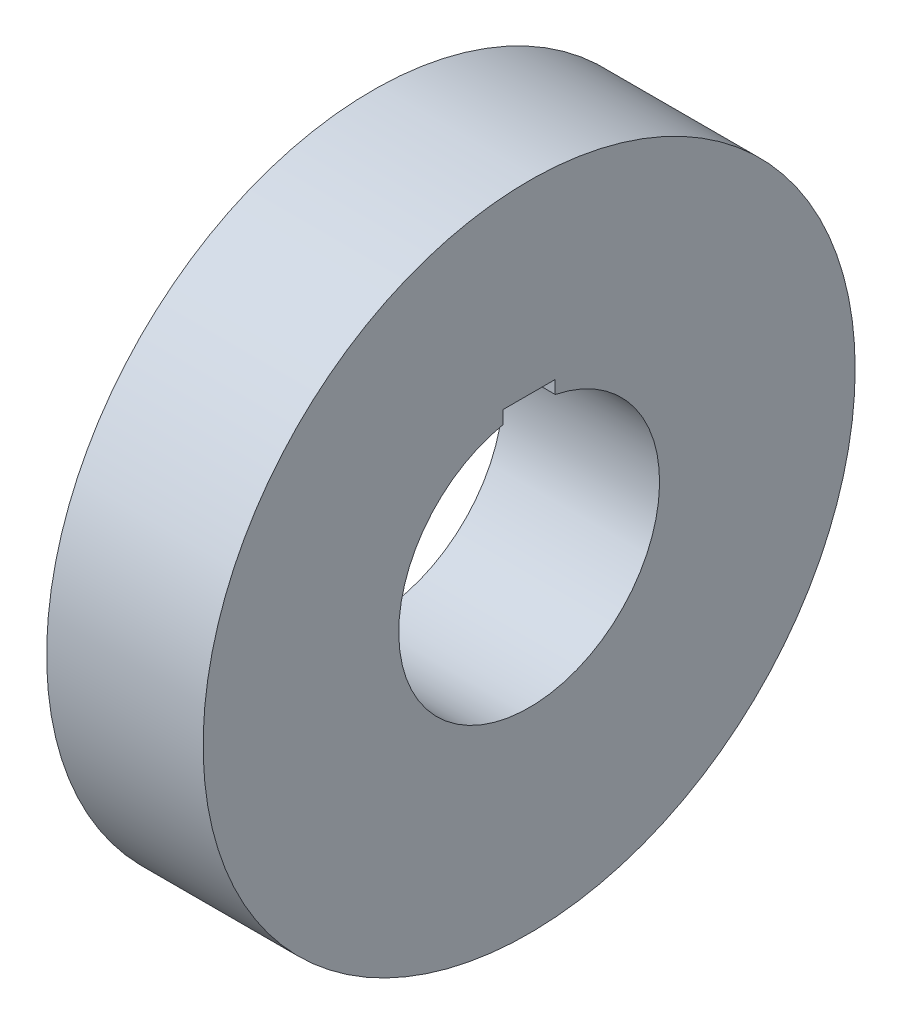
from build123d import *

# Parameters (mm, degrees)
SKETCH1_R           = 25
SKETCH1_R_2         = 10
BOSS_EXTRUDE1_DEPTH = 12
CUT_EXTRUDE1_DEPTH  = 38.336309405


with BuildPart() as part:
    # Sketch1 → Boss-Extrude1 (new body)
    with BuildSketch(Plane(origin=(0, 0, 0), x_dir=(0, 0, -1), z_dir=(1, 0, 0))):
        Circle(SKETCH1_R)
        Circle(SKETCH1_R_2, mode=Mode.SUBTRACT)
    extrude(amount=BOSS_EXTRUDE1_DEPTH)

    # Sketch2 → Cut-Extrude1 (cut, through all)
    with BuildSketch(Plane(origin=(12, 0, 0), x_dir=(0, 0, -1), z_dir=(1, 0, 0))):
        with BuildLine():
            ThreePointArc((-2, 9.797958971), (-1.00508962, 9.94936153), (0, 10))
            Line((0, 10), (0, 10.797958971))
            Line((0, 10.797958971), (-2, 10.797958971))
            Line((-2, 10.797958971), (-2, 9.797958971))
        make_face()
        with BuildLine():
            Line((0, 10.797958971), (0, 10))
            ThreePointArc((0, 10), (1.00508962, 9.94936153), (2, 9.797958971))
            Line((2, 9.797958971), (2, 10.797958971))
            Line((2, 10.797958971), (0, 10.797958971))
        make_face()
    extrude(amount=-CUT_EXTRUDE1_DEPTH, mode=Mode.SUBTRACT)


solid = part.part
